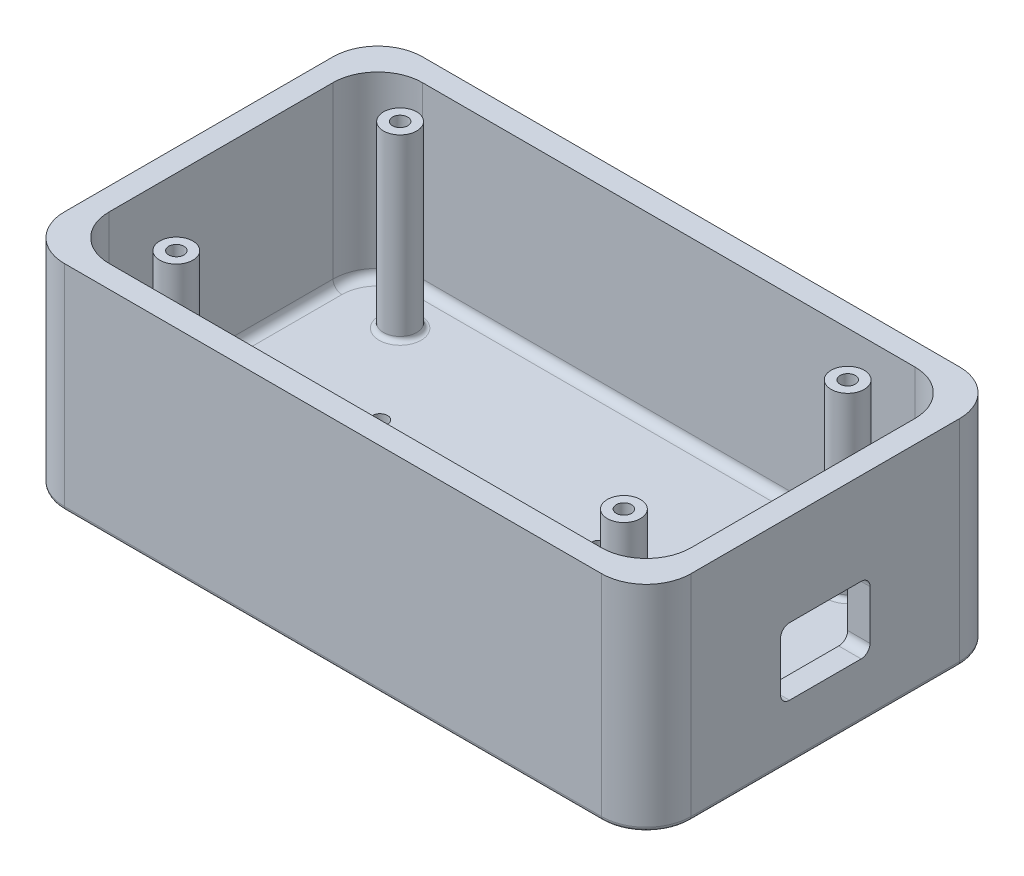
from build123d import *

# Parameters (mm, degrees)
BOSS_EXTRUDE1_DEPTH = 48
CUT_EXTRUDE1_DEPTH  = 40
SKETCH4_R           = 1.7
CUT_EXTRUDE2_DEPTH  = 91
CUT_EXTRUDE3_DEPTH  = 2.7
SKETCH6_R           = 3.7
BOSS_EXTRUDE2_DEPTH = 40
SKETCH7_R           = 1.7
CUT_EXTRUDE4_DEPTH  = 94.829632846
FILLET1_R           = 1
FILLET3_R           = 2
FILLET4_R           = 1
SKETCH8_R           = 1.7
CUT_EXTRUDE5_DEPTH  = 91.000000078
CUT_EXTRUDE6_DEPTH  = 2.7
CUT_EXTRUDE7_START  = -130
CUT_EXTRUDE7_DEPTH  = 20


with BuildPart() as part:
    # Sketch2 → Boss-Extrude1 (new body)
    with BuildSketch(Plane(origin=(0, 0, 0), x_dir=(1, 0, 0), z_dir=(0, 1, 0))):
        with BuildLine():
            Line((-60, -40), (60, -40))
            ThreePointArc((60, -40), (67.071067812, -37.071067812), (70, -30))
            Line((70, -30), (70, 30))
            ThreePointArc((70, 30), (67.071067812, 37.071067812), (60, 40))
            Line((60, 40), (-60, 40))
            ThreePointArc((-60, 40), (-67.071067812, 37.071067812), (-70, 30))
            Line((-70, 30), (-70, -30))
            ThreePointArc((-70, -30), (-67.071067812, -37.071067812), (-60, -40))
        make_face()
    extrude(amount=BOSS_EXTRUDE1_DEPTH)

    # Sketch3 → Cut-Extrude1 (cut)
    with BuildSketch(Plane(origin=(0, 48, 0), x_dir=(1, 0, 0), z_dir=(0, 1, 0))):
        with BuildLine():
            Line((-55, -35), (55, -35))
            ThreePointArc((55, -35), (62.071067812, -32.071067812), (65, -25))
            Line((65, -25), (65, 25))
            ThreePointArc((65, 25), (62.071067812, 32.071067812), (55, 35))
            Line((55, 35), (-55, 35))
            ThreePointArc((-55, 35), (-62.071067812, 32.071067812), (-65, 25))
            Line((-65, 25), (-65, -25))
            ThreePointArc((-65, -25), (-62.071067812, -32.071067812), (-55, -35))
        make_face()
    extrude(amount=-CUT_EXTRUDE1_DEPTH, mode=Mode.SUBTRACT)

    # Sketch4 → Cut-Extrude2 (cut, through all)
    with BuildSketch(Plane(origin=(0, 8, 0), x_dir=(1, 0, 0), z_dir=(0, 1, 0))):
        with Locations(Location((-50, 25, 0), (0, 0, 270))):
            Circle(SKETCH4_R)
        with Locations(Location((50, 25, 0), (0, 0, 270))):
            Circle(SKETCH4_R)
        with Locations(Location((50, -25, 0), (0, 0, 270))):
            Circle(SKETCH4_R)
        with Locations(Location((-50, -25, 0), (0, 0, 270))):
            Circle(SKETCH4_R)
    extrude(amount=-CUT_EXTRUDE2_DEPTH, mode=Mode.SUBTRACT)

    # Sketch5 → Cut-Extrude3 (cut)
    with BuildSketch(Plane(origin=(0, 0, 0), x_dir=(-1, 0, 0), z_dir=(0, -1, 0))):
        Polygon((53, -25), (51.5, -22.401923789), (48.5, -22.401923789), (47, -25), (48.5, -27.598076211), (51.5, -27.598076211), align=None)
        Polygon((47, 25), (48.5, 22.401923789), (51.5, 22.401923789), (53, 25), (51.5, 27.598076211), (48.5, 27.598076211), align=None)
        Polygon((-53, 25), (-51.5, 22.401923789), (-48.5, 22.401923789), (-47, 25), (-48.5, 27.598076211), (-51.5, 27.598076211), align=None)
        Polygon((-53, -25), (-51.5, -27.598076211), (-48.5, -27.598076211), (-47, -25), (-48.5, -22.401923789), (-51.5, -22.401923789), align=None)
    extrude(amount=-CUT_EXTRUDE3_DEPTH, mode=Mode.SUBTRACT)

    # Sketch6 → Boss-Extrude2 (add)
    with BuildSketch(Plane(origin=(0, 8, 0), x_dir=(1, 0, 0), z_dir=(0, 1, 0))):
        with Locations(Location((-50, 25, 0), (0, 0, 90))):
            Circle(SKETCH6_R)
        with Locations(Location((-50, -25, 0), (0, 0, 90))):
            Circle(SKETCH6_R)
        with Locations(Location((50, 25, 0), (0, 0, 90))):
            Circle(SKETCH6_R)
        with Locations(Location((50, -25, 0), (0, 0, 90))):
            Circle(SKETCH6_R)
    extrude(amount=BOSS_EXTRUDE2_DEPTH)

    # Sketch7 → Cut-Extrude4 (cut, through all)
    with BuildSketch(Plane(origin=(0, 48, 0), x_dir=(1, 0, 0), z_dir=(0, 1, 0))):
        with Locations(Location((-50, 25, 0), (0, 0, 270))):
            Circle(SKETCH7_R)
        with Locations(Location((50, 25, 0), (0, 0, 270))):
            Circle(SKETCH7_R)
        with Locations(Location((-50, -25, 0), (0, 0, 270))):
            Circle(SKETCH7_R)
        with Locations(Location((50, -25, 0), (0, 0, 270))):
            Circle(SKETCH7_R)
    extrude(amount=-CUT_EXTRUDE4_DEPTH, mode=Mode.SUBTRACT)

    # Fillet1
    fillet1_edges = [part.edges().sort_by_distance(p)[0] for p in [
        (0, 0, -40),
        (67.071067812, 0, -37.071067812),
        (70, 0, 0),
        (67.071067812, 0, 37.071067812),
        (0, 0, 40),
        (-67.071067812, 0, 37.071067812),
        (-70, 0, 0),
        (-67.071067812, 0, -37.071067812),
    ]]
    fillet(fillet1_edges, radius=FILLET1_R)

    # Fillet3
    fillet3_edges = [part.edges().sort_by_distance(p)[0] for p in [
        (62.071067812, 8, -32.071067812),
        (65, 8, 0),
        (62.071067812, 8, 32.071067812),
        (0, 8, 35),
        (-62.071067812, 8, 32.071067812),
        (-65, 8, 0),
        (-62.071067812, 8, -32.071067812),
        (0, 8, -35),
    ]]
    fillet(fillet3_edges, radius=FILLET3_R)

    # Fillet4
    fillet4_edges = [part.edges().sort_by_distance(p)[0] for p in [
        (-50, 8, -21.3),
        (50, 8, 28.7),
        (50, 8, -21.3),
        (-50, 8, 28.7),
    ]]
    fillet(fillet4_edges, radius=FILLET4_R)

    # Sketch8 → Cut-Extrude5 (cut, through all)
    with BuildSketch(Plane(origin=(0, 8, 0), x_dir=(1, 0, 0), z_dir=(0, 1, 0))):
        with Locations(Location((-34.5, 5, 0), (0, 0, 270))):
            Circle(SKETCH8_R)
        with Locations(Location((-34.5, -5, 0), (0, 0, 270))):
            Circle(SKETCH8_R)
        with Locations(Location((14.5, 5, 0), (0, 0, 270))):
            Circle(SKETCH8_R)
        with Locations(Location((14.5, -5, 0), (0, 0, 270))):
            Circle(SKETCH8_R)
    extrude(amount=-CUT_EXTRUDE5_DEPTH, mode=Mode.SUBTRACT)

    # Sketch9 → Cut-Extrude6 (cut)
    with BuildSketch(Plane(origin=(0, 0, 0), x_dir=(-1, 0, 0), z_dir=(0, -1, 0))):
        Polygon((-17.5, -5), (-16, -7.598076211), (-13, -7.598076211), (-11.5, -5), (-13, -2.401923789), (-16, -2.401923789), align=None)
        Polygon((-17.5, 5), (-16, 2.401923789), (-13, 2.401923789), (-11.5, 5), (-13, 7.598076211), (-16, 7.598076211), align=None)
        Polygon((31.5, 5), (33, 2.401923789), (36, 2.401923789), (37.5, 5), (36, 7.598076211), (33, 7.598076211), align=None)
        Polygon((31.5, -5), (33, -7.598076211), (36, -7.598076211), (37.5, -5), (36, -2.401923789), (33, -2.401923789), align=None)
    extrude(amount=-CUT_EXTRUDE6_DEPTH, mode=Mode.SUBTRACT)

    # Sketch10 → Cut-Extrude7 (cut)
    with BuildSketch(Plane.ZY.offset(70).offset(CUT_EXTRUDE7_START)):
        with BuildLine():
            Line((-8, 12.5), (8, 12.5))
            ThreePointArc((8, 12.5), (9.414213562, 13.085786438), (10, 14.5))
            Line((10, 14.5), (10, 25.5))
            ThreePointArc((10, 25.5), (9.414213562, 26.914213562), (8, 27.5))
            Line((8, 27.5), (-8, 27.5))
            ThreePointArc((-8, 27.5), (-9.414213562, 26.914213562), (-10, 25.5))
            Line((-10, 25.5), (-10, 14.5))
            ThreePointArc((-10, 14.5), (-9.414213562, 13.085786438), (-8, 12.5))
        make_face()
    extrude(amount=-CUT_EXTRUDE7_DEPTH, mode=Mode.SUBTRACT)


solid = part.part
